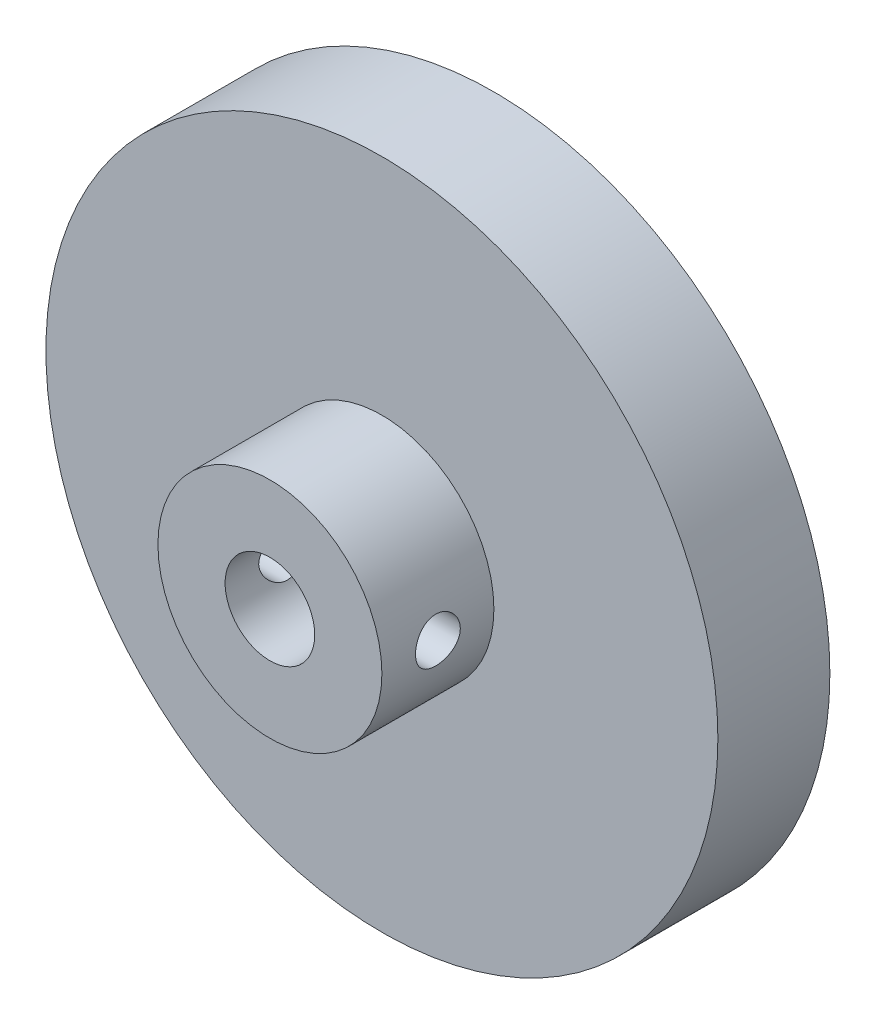
from build123d import *

# Parameters (mm, degrees)
SKETCH1_R               = 30
BOSS_EXTRUDE1_DEPTH     = 10
SKETCH2_R               = 10
SKETCH2_R_2             = 4
BOSS_EXTRUDE2_DEPTH     = 10
CUT_EXTRUDE1_DEPTH      = 10
CUT_EXTRUDE1_DEPTH_BACK = 10
SKETCH3_R               = 2


with BuildPart() as part:
    # Sketch1 → Boss-Extrude1 (new body)
    with BuildSketch(Plane.XY):
        Circle(SKETCH1_R)
    extrude(amount=BOSS_EXTRUDE1_DEPTH)

    # Sketch2 → Boss-Extrude2 (add)
    with BuildSketch(Plane.XY.offset(10)):
        Circle(SKETCH2_R)
        Circle(SKETCH2_R_2, mode=Mode.SUBTRACT)
    extrude(amount=BOSS_EXTRUDE2_DEPTH)

    # Sketch3 → Cut-Extrude1 (cut, two sides: drawn at the far end of the back side and taken through both)
    with BuildSketch(Plane(origin=(0, 0, 0), x_dir=(0, 0, -1), z_dir=(1, 0, 0)).offset(-CUT_EXTRUDE1_DEPTH_BACK)):
        with Locations((-15, 0)):
            Circle(SKETCH3_R)
    extrude(amount=CUT_EXTRUDE1_DEPTH + CUT_EXTRUDE1_DEPTH_BACK, mode=Mode.SUBTRACT)


solid = part.part
